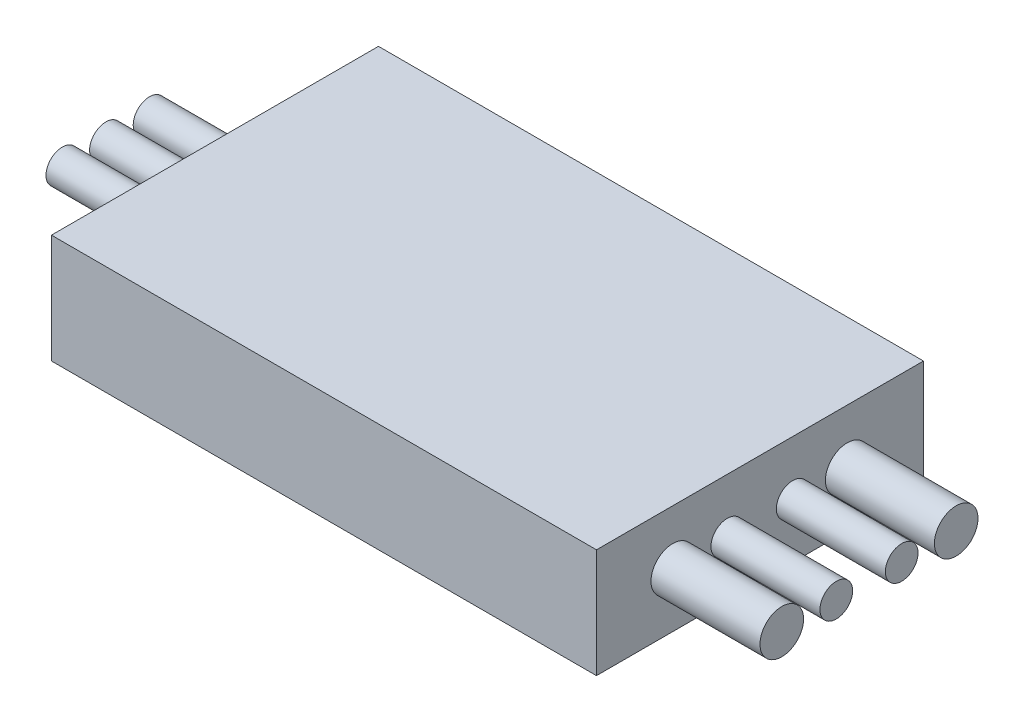
from build123d import *

# Parameters (mm, degrees)
SKETCH1_W           = 25
SKETCH1_H           = 15
BOSS_EXTRUDE1_DEPTH = 5
SKETCH2_R           = 1
SKETCH2_R_2         = 0.75
BOSS_EXTRUDE2_DEPTH = 5
SKETCH3_R           = 0.75
BOSS_EXTRUDE3_DEPTH = 5


with BuildPart() as part:
    # Sketch1 → Boss-Extrude1 (new body)
    with BuildSketch(Plane(origin=(0, 0, 0), x_dir=(1, 0, 0), z_dir=(0, 1, 0))):
        with Locations((12.5, 7.5)):
            Rectangle(SKETCH1_W, SKETCH1_H)
    extrude(amount=BOSS_EXTRUDE1_DEPTH)

    # Sketch2 → Boss-Extrude2 (add)
    with BuildSketch(Plane(origin=(25, 0, 0), x_dir=(0, 0, -1), z_dir=(1, 0, 0))):
        with Locations(Location((11.5, 2.5, 0), (0, 0, 180))):
            Circle(SKETCH2_R)
        with Locations(Location((6, 2.5, 0), (0, 0, 180))):
            Circle(SKETCH2_R_2)
        with Locations(Location((9, 2.5, 0), (0, 0, 180))):
            Circle(SKETCH2_R_2)
        with Locations(Location((3.5, 2.5, 0), (0, 0, 180))):
            Circle(SKETCH2_R)
    extrude(amount=BOSS_EXTRUDE2_DEPTH)

    # Sketch3 → Boss-Extrude3 (add)
    with BuildSketch(Plane.ZY):
        with Locations(Location((-9.5, 2.5, 0), (0, 0, 180))):
            Circle(SKETCH3_R)
        with Locations(Location((-7.5, 2.5, 0), (0, 0, 180))):
            Circle(SKETCH3_R)
        with Locations(Location((-5.5, 2.5, 0), (0, 0, 180))):
            Circle(SKETCH3_R)
    extrude(amount=BOSS_EXTRUDE3_DEPTH)


solid = part.part
